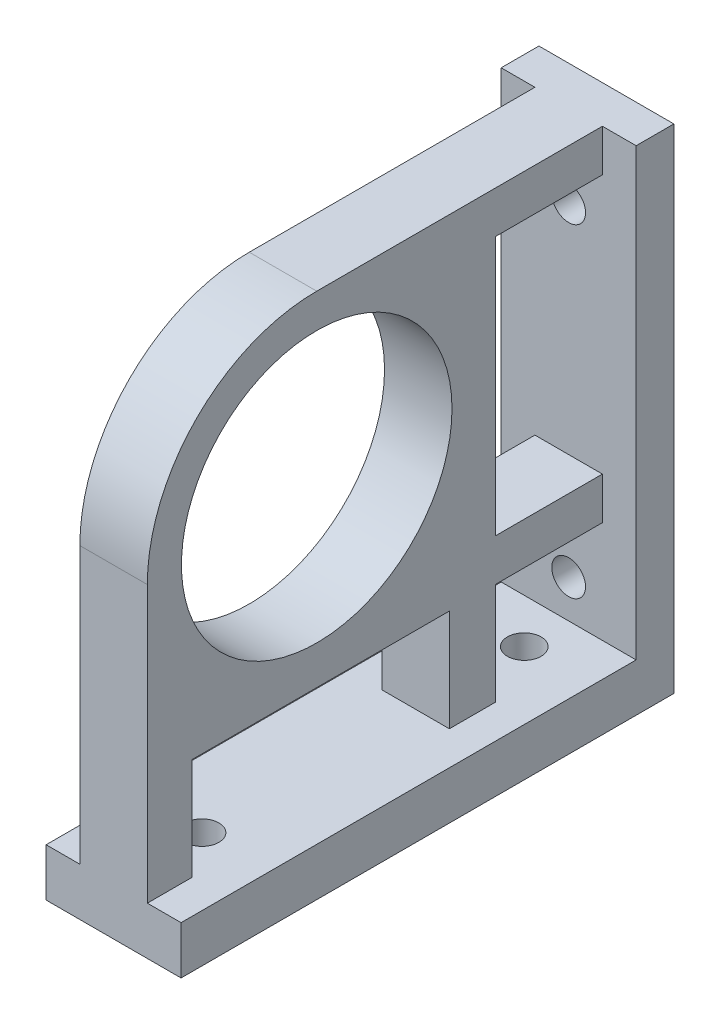
from build123d import *

# Parameters (mm, degrees)
SKETCH1_R                = 25.4635
BOSS_EXTRUDE1_DEPTH      = 12.7
BOSS_EXTRUDE2_DEPTH      = 6.35
BOSS_EXTRUDE2_DEPTH_BACK = 19.05
SKETCH4_W                = 20.078494948
SKETCH4_H                = 48.78095735
SKETCH4_W_2              = 48.420880553
SKETCH4_H_2              = 19.195923741
CUT_EXTRUDE2_DEPTH       = 26.162
SKETCH5_R                = 3.175
CUT_EXTRUDE3_DEPTH       = 11.43
SKETCH6_R                = 3.175
CUT_EXTRUDE4_DEPTH       = 11.43


with BuildPart() as part:
    # Sketch1 → Boss-Extrude1 (new body)
    with BuildSketch(Plane(origin=(0, 0, 0), x_dir=(0, 0, -1), z_dir=(1, 0, 0))):
        with BuildLine():
            Line((0, 31.882172919), (31.882172919, 31.882172919))
            Line((31.882172919, 31.882172919), (60.87463474, 31.882172919))
            Line((60.87463474, 31.882172919), (60.87463474, -60.96))
            Line((60.87463474, -60.96), (-31.882172919, -60.96))
            Line((-31.882172919, -60.96), (-31.882172919, 0))
            ThreePointArc((-31.882172919, 0), (-22.54410067, 22.54410067), (0, 31.882172919))
        make_face()
        Circle(SKETCH1_R, mode=Mode.SUBTRACT)
    extrude(amount=BOSS_EXTRUDE1_DEPTH)

    # Sketch8 → Boss-Extrude2 (add, two sides: drawn at the far end of the back side and taken through both)
    with BuildSketch(Plane(origin=(12.7, 0, 0), x_dir=(0, 0, -1), z_dir=(1, 0, 0)).offset(-BOSS_EXTRUDE2_DEPTH_BACK)):
        Polygon((60.87463474, 31.882172919), (53.770648903, 31.882172919), (53.770648903, -51.937867719), (-31.882172919, -51.937867719), (-31.882172919, -60.96), (53.770648903, -60.96), (60.87463474, -60.96), align=None)
    extrude(amount=BOSS_EXTRUDE2_DEPTH + BOSS_EXTRUDE2_DEPTH_BACK)

    # Sketch4 → Cut-Extrude2 (cut)
    with BuildSketch(Plane.ZY):
        with Locations((-43.731401429, -0.427222634)):
            Rectangle(SKETCH4_W, SKETCH4_H)
        with Locations((-0.75610861, -42.339905849)):
            Rectangle(SKETCH4_W_2, SKETCH4_H_2)
        with Locations((-43.731401429, -42.339905849)):
            Rectangle(SKETCH4_W, SKETCH4_H_2)
    extrude(amount=-CUT_EXTRUDE2_DEPTH, mode=Mode.SUBTRACT)

    # Sketch5 → Cut-Extrude3 (cut)
    with BuildSketch(Plane(origin=(0, 0, -60.87463474), x_dir=(-1, 0, 0), z_dir=(0, 0, -1))):
        with Locations((-6.35, 16.187024645)):
            Circle(SKETCH5_R)
        with Locations((-6.35, -44.788648077)):
            Circle(SKETCH5_R)
    extrude(amount=-CUT_EXTRUDE3_DEPTH, mode=Mode.SUBTRACT)

    # Sketch6 → Cut-Extrude4 (cut)
    with BuildSketch(Plane.XZ.offset(60.96)):
        with Locations((6.35, 15.24)):
            Circle(SKETCH6_R)
        with Locations((6.35, -45.41055385)):
            Circle(SKETCH6_R)
    extrude(amount=-CUT_EXTRUDE4_DEPTH, mode=Mode.SUBTRACT)


solid = part.part
